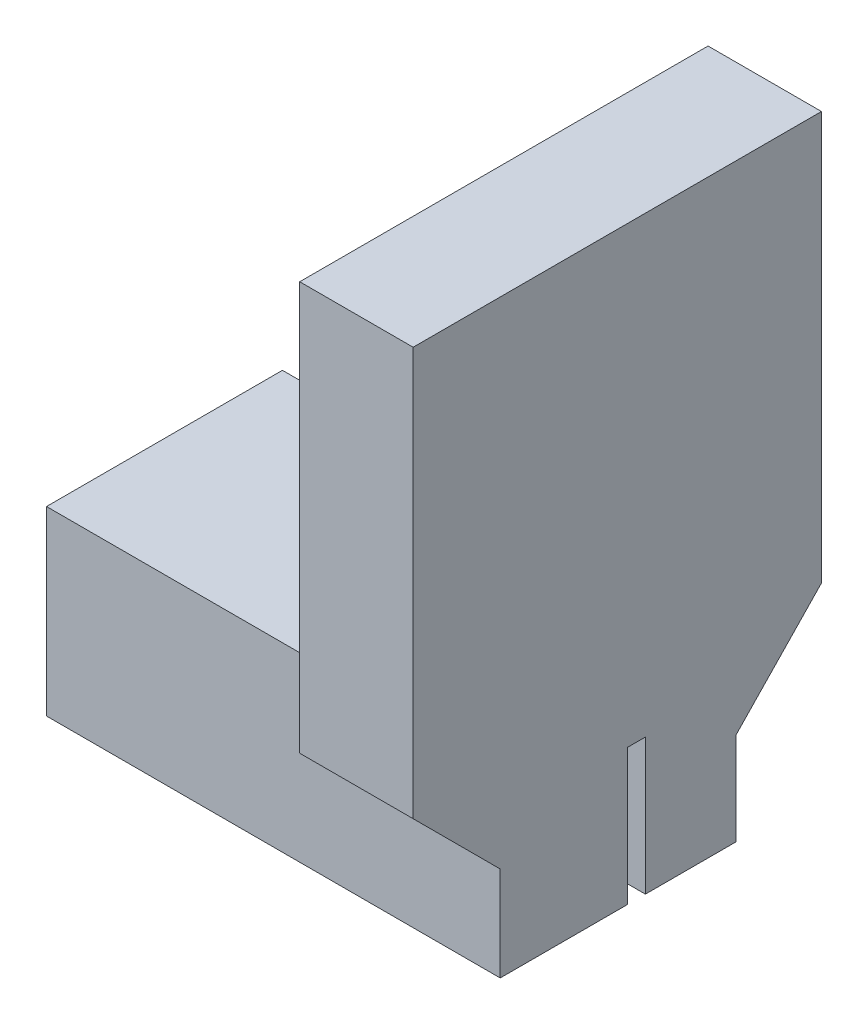
from build123d import *

# Parameters (mm, degrees)
SKETCH1_W             = 20
SKETCH1_H             = 4
BOSS_EXTRUDE1_DEPTH   = 6
BOSS_EXTRUDE1_2_DEPTH = 6
BOSS_EXTRUDE2_DEPTH   = 6
LPATTERN1_COUNT       = 5
LPATTERN1_PITCH       = 2
SKETCH4_W             = 20
SKETCH4_H             = 10.4
BOSS_EXTRUDE3_DEPTH   = 2
BOSS_EXTRUDE4_DEPTH   = 5


with BuildPart() as part:
    # Sketch1 → Boss-Extrude1 (new body)
    with BuildSketch(Plane(origin=(0, 0, 0), x_dir=(1, 0, 0), z_dir=(0, 1, 0))):
        with Locations((10, 3.2)):
            Rectangle(SKETCH1_W, SKETCH1_H)
    extrude(amount=BOSS_EXTRUDE1_DEPTH)



with BuildPart() as body_2:
    # Sketch1 → Boss-Extrude1 2 (new body)
    with BuildSketch(Plane(origin=(0, 0, 0), x_dir=(1, 0, 0), z_dir=(0, 1, 0))):
        with Locations((10, -3.2)):
            Rectangle(SKETCH1_W, SKETCH1_H)
    extrude(amount=BOSS_EXTRUDE1_2_DEPTH)

    # Sketch3 → Boss-Extrude2 (add)
    with BuildSketch(Plane.XZ):
        with BuildLine():
            Line((17.48035085, -0.4), (18, -0.4))
            ThreePointArc((18, -0.4), (18.098907071, -0.362771412), (18.148718534, -0.269565217))
            ThreePointArc((18.148718534, -0.269565217), (18.182563711, -0.111937846), (18.241299021, 0.038202247))
            ThreePointArc((18.241299021, 0.038202247), (18.740175425, 0.35), (19.23905183, 0.038202247))
            ThreePointArc((19.23905183, 0.038202247), (19.297787139, -0.111937846), (19.331632316, -0.269565217))
            ThreePointArc((19.331632316, -0.269565217), (19.381443779, -0.362771412), (19.48035085, -0.4))
            Line((19.48035085, -0.4), (20, -0.4))
            Line((20, -0.4), (20, 1.2))
            Line((20, 1.2), (17.48035085, 1.2))
            Line((17.48035085, 1.2), (17.48035085, -0.4))
        make_face()
    boss_extrude2 = extrude(amount=-BOSS_EXTRUDE2_DEPTH)

    # LPattern1: Boss-Extrude2 ×5
    with Locations(*[(-i * LPATTERN1_PITCH, 0, 0) for i in range(1, LPATTERN1_COUNT)]):
        add(boss_extrude2)


with BuildPart() as part_1:
    add(part.part)

    add(body_2.part)  # Boss-Extrude3 merges body 2
    # Sketch4 → Boss-Extrude3 (add)
    with BuildSketch(Plane(origin=(0, 6, 0), x_dir=(1, 0, 0), z_dir=(0, 1, 0))):
        with Locations((10, 0)):
            Rectangle(SKETCH4_W, SKETCH4_H)
    extrude(amount=BOSS_EXTRUDE3_DEPTH)

    # Sketch5 → Boss-Extrude4 (add)
    with BuildSketch(Plane(origin=(20, 0, 0), x_dir=(0, 0, -1), z_dir=(1, 0, 0))):
        Polygon((-9.038202247, 26), (8.961797753, 26), (8.961797753, 8), (5.2, 4.08688479), (5.2, 8), (-5.2, 8), (-5.2, 4.161797753), (-9.038202247, 8), align=None)
    extrude(amount=-BOSS_EXTRUDE4_DEPTH)


solid = part_1.part
